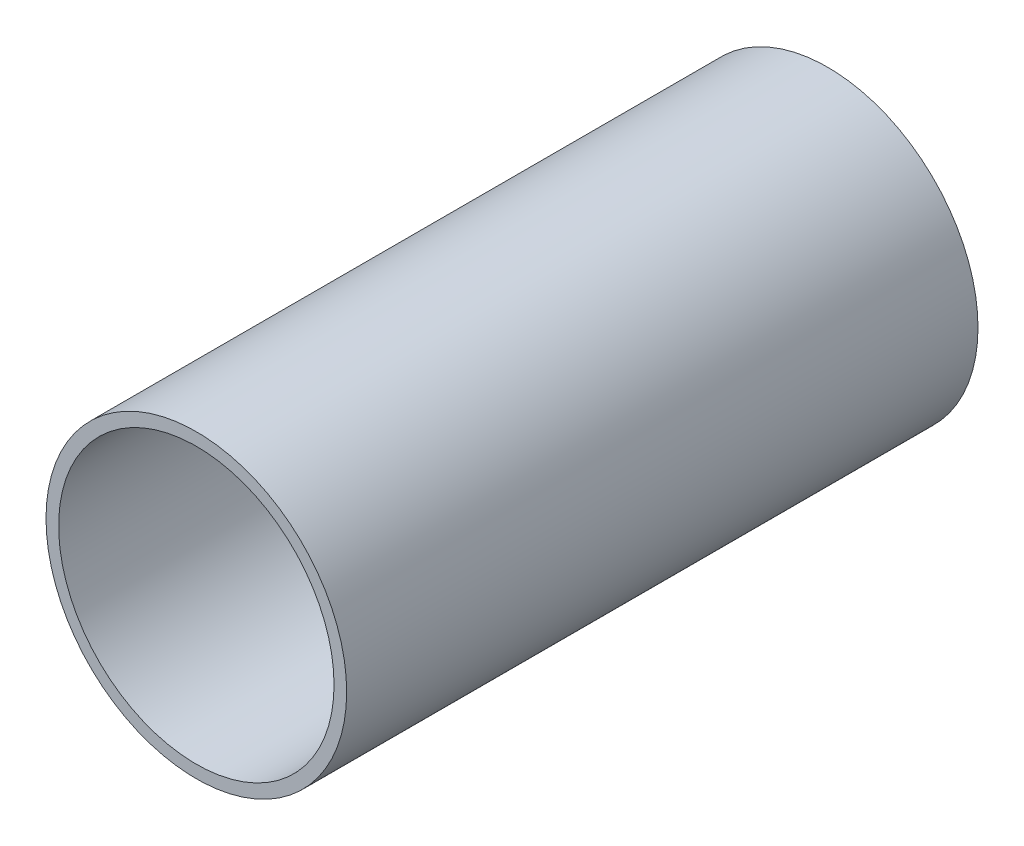
from build123d import *

# Parameters (mm, degrees)
SKETCH_1_R      = 19.05
SKETCH_1_R_2    = 17.45
EXTRUDE_1_DEPTH = 80


with BuildPart() as part:
    # 草圖1 → 填料-伸長1 (new body)
    with BuildSketch(Plane.XY):
        Circle(SKETCH_1_R)
        Circle(SKETCH_1_R_2, mode=Mode.SUBTRACT)
    extrude(amount=EXTRUDE_1_DEPTH)


solid = part.part
